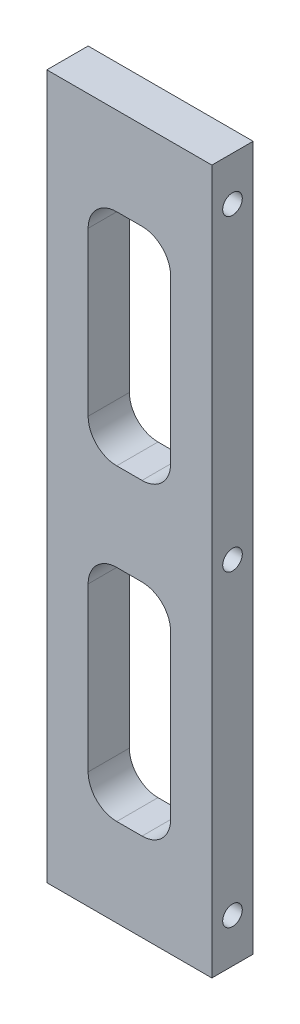
from build123d import *

# Parameters (mm, degrees)
SKETCH1_W             = 19.05
SKETCH1_H             = 81.28
BOSS_EXTRUDE1_DEPTH   = 4.7625
SKETCH2_W             = 9.525
SKETCH2_H             = 25.4
CUT_EXTRUDE1_DEPTH    = 43.01210101
FILLET1_R             = 3.302
F_4_40_TAPPED_HOLE1_D = 2.2606


with BuildPart() as part:
    # Sketch1 → Boss-Extrude1 (new body)
    with BuildSketch(Plane.XY):
        Rectangle(SKETCH1_W, SKETCH1_H)
    extrude(amount=BOSS_EXTRUDE1_DEPTH)

    # Sketch2 → Cut-Extrude1 (cut, through all)
    with BuildSketch(Plane.XY.offset(4.7625)):
        with Locations((0, 17.78)):
            Rectangle(SKETCH2_W, SKETCH2_H)
        with Locations((0, -17.78)):
            Rectangle(SKETCH2_W, SKETCH2_H)
    extrude(amount=-CUT_EXTRUDE1_DEPTH, mode=Mode.SUBTRACT)

    # Fillet1
    fillet1_edges = [part.edges().sort_by_distance(p)[0] for p in [
        (4.7625, 30.48, 2.38125),
        (4.7625, 5.08, 2.38125),
        (-4.7625, 5.08, 2.38125),
        (-4.7625, 30.48, 2.38125),
        (-4.7625, -30.48, 2.38125),
        (-4.7625, -5.08, 2.38125),
        (4.7625, -5.08, 2.38125),
        (4.7625, -30.48, 2.38125),
    ]]
    fillet(fillet1_edges, radius=FILLET1_R)

    # #4-40 Tapped Hole1 (through all)
    with Locations(Plane(origin=(9.525, 0, 0), x_dir=(0, 0, -1), z_dir=(1, 0, 0))):
        with Locations((-2.38125, 35.56), (-2.38125, 0), (-2.38125, -35.56)):
            Hole(F_4_40_TAPPED_HOLE1_D / 2)


solid = part.part
